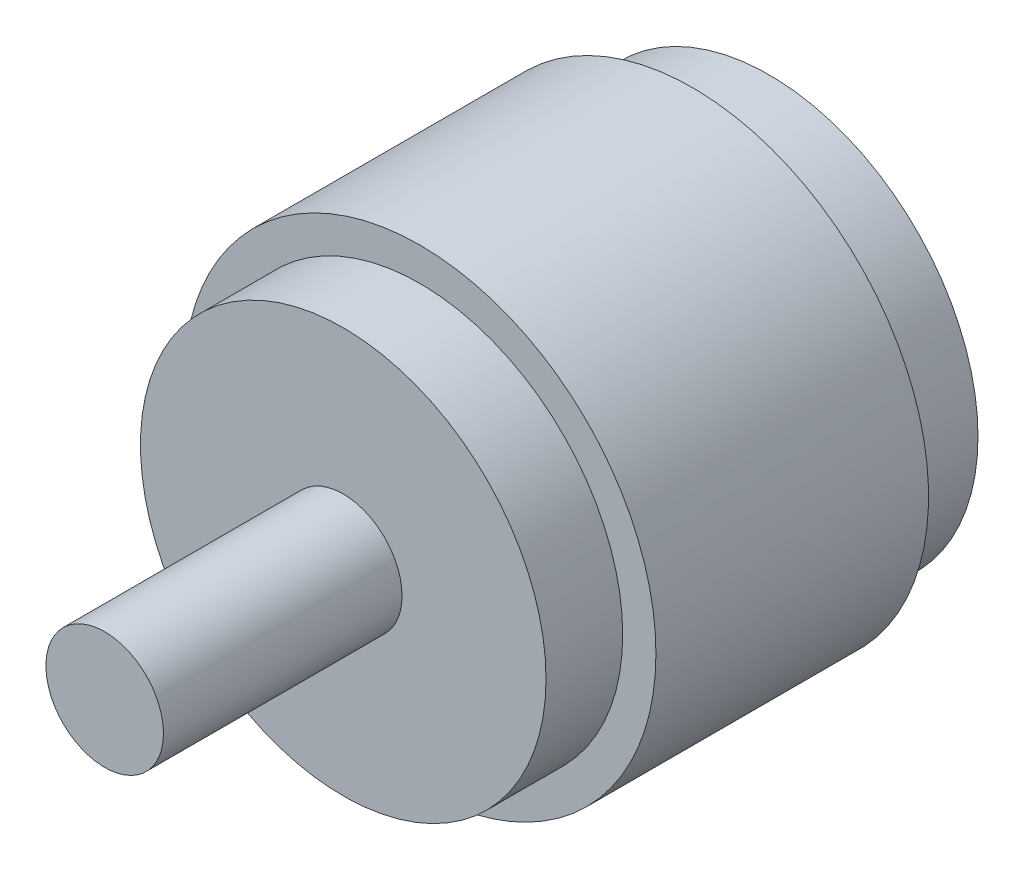
from build123d import *

# Parameters (mm, degrees)
SKETCH1_R                                       = 13.85
BOSS_EXTRUDE1_DEPTH                             = 25
SKETCH2_OUTSIDE_W                               = 38.994
SKETCH2_OUTSIDE_H                               = 38.994
SKETCH2_OUTSIDE_R                               = 11.9
CUT_EXTRUDE3_DEPTH                              = 4.5
SKETCH6_OUTSIDE_W                               = 38.994
SKETCH6_OUTSIDE_H                               = 38.994
SKETCH6_OUTSIDE_R                               = 12.25
CUT_EXTRUDE5_DEPTH                              = 4.5
SKETCH7_R                                       = 3.45
BOSS_EXTRUDE2_DEPTH                             = 14
CSK_FOR_M3_OVAL_HEAD_MACHINE_SCREW2_D           = 3.4
CSK_FOR_M3_OVAL_HEAD_MACHINE_SCREW2_DEPTH       = 5
CSK_FOR_M3_OVAL_HEAD_MACHINE_SCREW2_CSINK_D     = 4
CSK_FOR_M3_OVAL_HEAD_MACHINE_SCREW2_CSINK_ANGLE = 90
CSK_FOR_M3_OVAL_HEAD_MACHINE_SCREW2_TIP         = 1.021463052


with BuildPart() as part:
    # Sketch1 → Boss-Extrude1 (new body)
    with BuildSketch(Plane.XY):
        Circle(SKETCH1_R)
    extrude(amount=BOSS_EXTRUDE1_DEPTH)

    # Sketch2 outside → Cut-Extrude3 (cut)
    with BuildSketch(Plane.XY.offset(25)):
        Rectangle(SKETCH2_OUTSIDE_W, SKETCH2_OUTSIDE_H)
        Circle(SKETCH2_OUTSIDE_R, mode=Mode.SUBTRACT)
    extrude(amount=-CUT_EXTRUDE3_DEPTH, mode=Mode.SUBTRACT)

    # Sketch6 outside → Cut-Extrude5 (cut)
    with BuildSketch(Plane(origin=(0, 0, 0), x_dir=(-1, 0, 0), z_dir=(0, 0, -1))):
        Rectangle(SKETCH6_OUTSIDE_W, SKETCH6_OUTSIDE_H)
        Circle(SKETCH6_OUTSIDE_R, mode=Mode.SUBTRACT)
    extrude(amount=-CUT_EXTRUDE5_DEPTH, mode=Mode.SUBTRACT)

    # Sketch7 → Boss-Extrude2 (add)
    with BuildSketch(Plane.XY.offset(25)):
        Circle(SKETCH7_R)
    extrude(amount=BOSS_EXTRUDE2_DEPTH)

    # CSK for M3 Oval Head Machine Screw2
    with Locations(Plane(origin=(0, 0, 0), x_dir=(-1, 0, 0), z_dir=(0, 0, -1))):
        with Locations((-6.125, 5.304405598), (6.125, 5.304405598), (6.125, -5.304405598), (-6.125, -5.304405598)):
            CounterSinkHole(CSK_FOR_M3_OVAL_HEAD_MACHINE_SCREW2_D / 2, CSK_FOR_M3_OVAL_HEAD_MACHINE_SCREW2_CSINK_D / 2, depth=CSK_FOR_M3_OVAL_HEAD_MACHINE_SCREW2_DEPTH, counter_sink_angle=CSK_FOR_M3_OVAL_HEAD_MACHINE_SCREW2_CSINK_ANGLE)
            with Locations((0, 0, -(CSK_FOR_M3_OVAL_HEAD_MACHINE_SCREW2_DEPTH + CSK_FOR_M3_OVAL_HEAD_MACHINE_SCREW2_TIP / 2))):  # 118° drill point
                Cone(0, CSK_FOR_M3_OVAL_HEAD_MACHINE_SCREW2_D / 2, CSK_FOR_M3_OVAL_HEAD_MACHINE_SCREW2_TIP, mode=Mode.SUBTRACT)


solid = part.part
